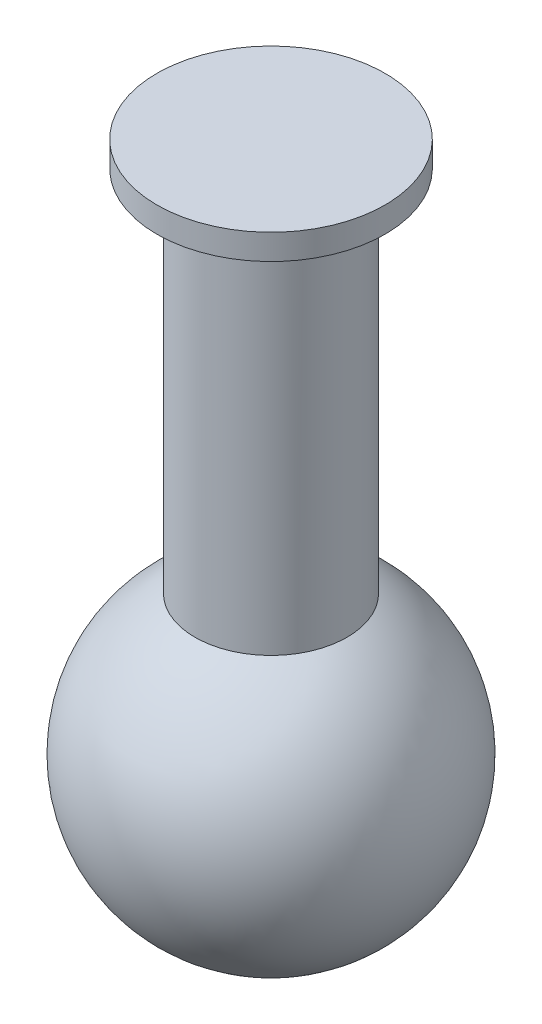
from build123d import *

# Parameters (mm, degrees)
SKETCH2_R           = 7.62
BOSS_EXTRUDE1_DEPTH = 50.8
SKETCH3_R           = 11.43
BOSS_EXTRUDE2_DEPTH = 2.54


with BuildPart() as part:
    # Sketch1 → Revolve1 (revolve)
    with BuildSketch(Plane.XY):
        with BuildLine():
            Line((0, -15.875), (0, 15.875))
            ThreePointArc((0, 15.875), (15.875, 0), (0, -15.875))
        make_face()
    revolve(axis=Axis((0, -15.875, 0), (0, 1, 0)))

    # Sketch2 → Boss-Extrude1 (add)
    with BuildSketch(Plane(origin=(0, 0, 0), x_dir=(1, 0, 0), z_dir=(0, 1, 0))):
        with Locations(Location((0, 0, 0), (0, 0, 90))):
            Circle(SKETCH2_R)
    extrude(amount=BOSS_EXTRUDE1_DEPTH)

    # Sketch3 → Boss-Extrude2 (add)
    with BuildSketch(Plane(origin=(0, 50.8, 0), x_dir=(1, 0, 0), z_dir=(0, 1, 0))):
        with Locations(Location((0, 0, 0), (0, 0, 270))):
            Circle(SKETCH3_R)
    extrude(amount=BOSS_EXTRUDE2_DEPTH)


solid = part.part
